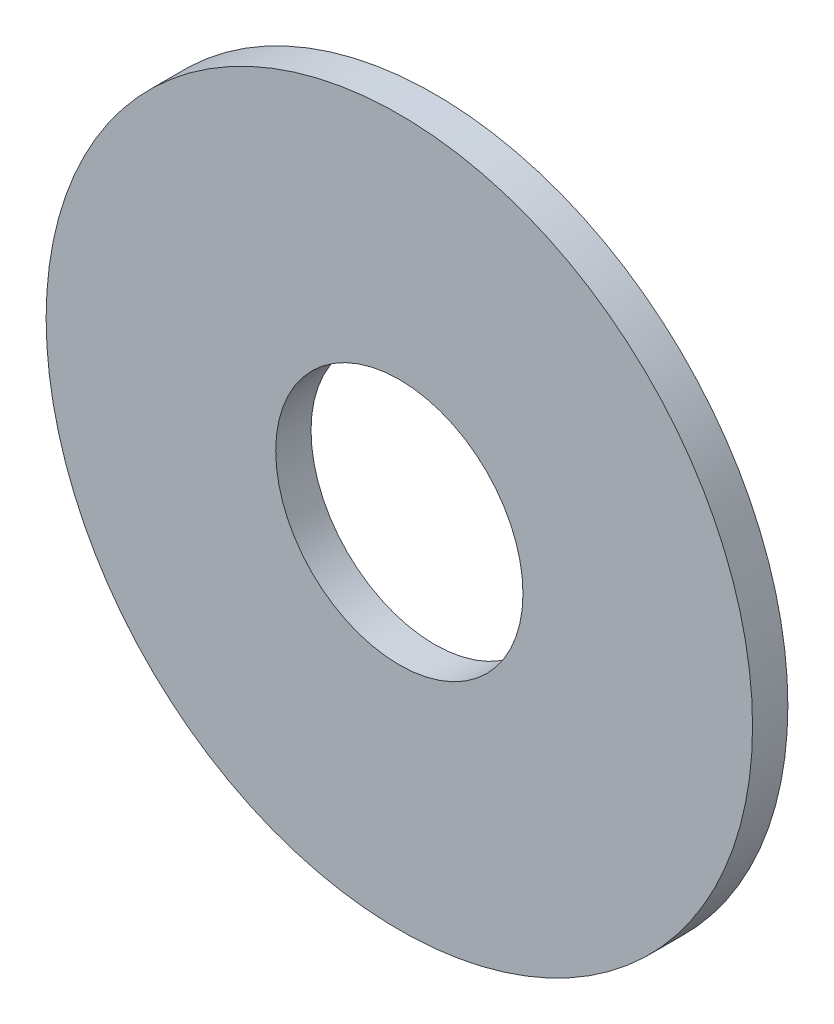
from build123d import *

# Parameters (mm, degrees)
SKETCH_1_R      = 20
SKETCH_1_R_2    = 7
EXTRUDE_1_DEPTH = 2


with BuildPart() as part:
    # Эскиз1 → Вытянуть1 (new body)
    with BuildSketch(Plane.XY):
        Circle(SKETCH_1_R)
        Circle(SKETCH_1_R_2, mode=Mode.SUBTRACT)
    extrude(amount=EXTRUDE_1_DEPTH)


solid = part.part
